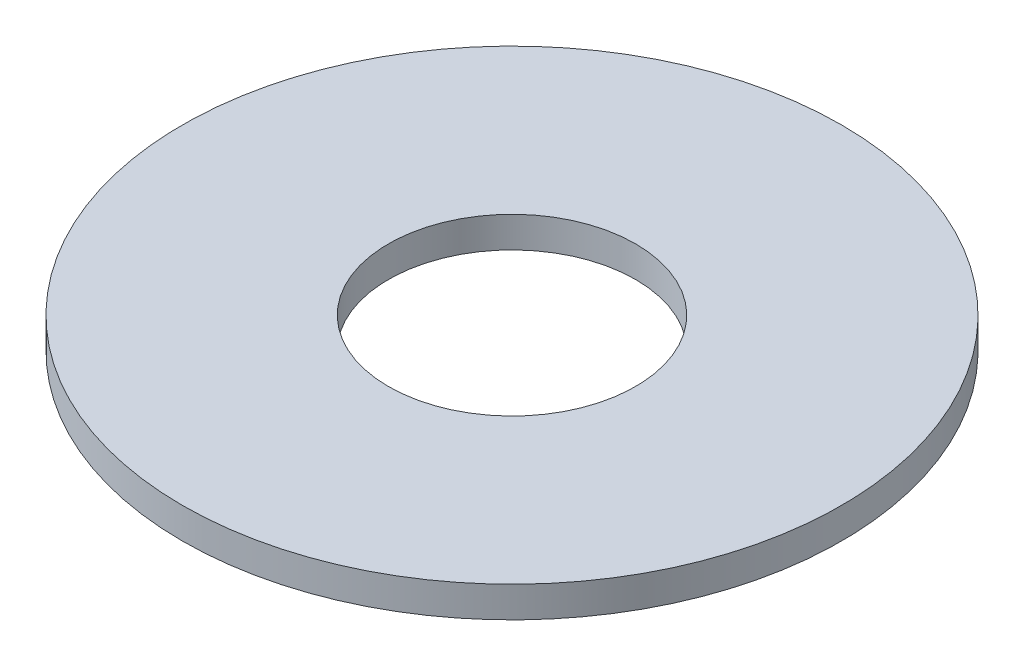
from build123d import *

# Parameters (mm, degrees)
SKETCH1_R           = 16
SKETCH1_R_2         = 6
BOSS_EXTRUDE1_DEPTH = 1.5


with BuildPart() as part:
    # Sketch1 → Boss-Extrude1 (new body)
    with BuildSketch(Plane(origin=(0, 0, 0), x_dir=(1, 0, 0), z_dir=(0, 1, 0))):
        with Locations(Location((0, 0, 0), (0, 0, 270))):
            Circle(SKETCH1_R)
        with Locations(Location((0, 0, 0), (0, 0, 270))):
            Circle(SKETCH1_R_2, mode=Mode.SUBTRACT)
    extrude(amount=BOSS_EXTRUDE1_DEPTH)


solid = part.part
